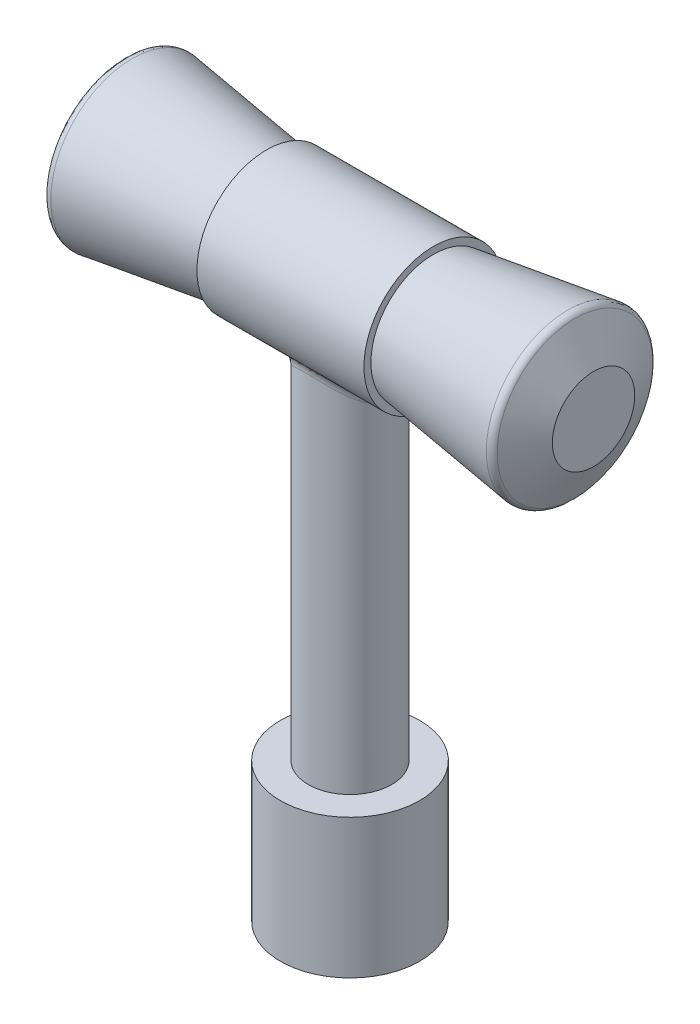
from build123d import *

# Parameters (mm, degrees)
SKETCH3_R                            = 5
BOSS_EXTRUDE1_DEPTH                  = 6
SKETCH4_R                            = 4.5
BOSS_EXTRUDE2_DEPTH                  = 10
BOSS_EXTRUDE2_DRAFT                  = -8
MIRROR1_COPY_1_SKETCH_R              = 4.5
MIRROR1_COPY_1_DEPTH                 = 10
MIRROR1_COPY_1_DRAFT                 = -8
SKETCH5_R                            = 3
BOSS_EXTRUDE3_DEPTH                  = 25
BOSS_EXTRUDE3_DIRECTION_2_REACH      = 22.244
BOSS_EXTRUDE3_DIRECTION_2_END_RADIUS = 5
SKETCH6_R                            = 5
BOSS_EXTRUDE4_DEPTH                  = 10
F_5_0MM_DOWEL_HOLE1_D                = 5
F_5_0MM_DOWEL_HOLE1_DEPTH            = 10
F_5_0MM_DOWEL_HOLE1_TIP              = 1.502151548
SKETCH9_R                            = 5.905408347
BOSS_EXTRUDE5_DEPTH                  = 1.5
BOSS_EXTRUDE5_TAPER                  = 63
FILLET1_R                            = 1
FILLET2_R                            = 0.5


with BuildPart() as part:
    # Sketch3 → Boss-Extrude1 (new, symmetric)
    with BuildSketch(Plane(origin=(0, 0, 0), x_dir=(0, 0, -1), z_dir=(1, 0, 0))):
        with Locations((0, 40)):
            Circle(SKETCH3_R)
    extrude(amount=BOSS_EXTRUDE1_DEPTH, both=True)


with BuildPart() as boss_extrude2_tool:
    # Sketch4 → Boss-Extrude2 (with draft: the straight prism first)
    with BuildSketch(Plane(origin=(6, 0, 0), x_dir=(0, 0, -1), z_dir=(1, 0, 0))):
        with Locations((0, 40)):
            Circle(SKETCH4_R)
    extrude(amount=BOSS_EXTRUDE2_DEPTH)
    # Boss-Extrude2: the draft: its side faces are tilted about the plane it starts from
    boss_extrude2_sides = [boss_extrude2_tool.faces().sort_by_distance(p)[0] for p in [
        (11, 40, 4.5),
    ]]
    draft(boss_extrude2_sides, Plane(origin=(6, 0, 0), x_dir=(0, 0, -1), z_dir=(1, 0, 0)), BOSS_EXTRUDE2_DRAFT)


with BuildPart() as part_1:
    add(part.part)

    # Boss-Extrude2: add boss_extrude2_tool
    add(boss_extrude2_tool.part)


with BuildPart() as mirror1_copy_1_tool:
    # Mirror1 copy 1 sketch → Mirror1 copy 1 (with draft: the straight prism first)
    with BuildSketch(Plane(origin=(-6, 0, 0), x_dir=(0, 0, -1), z_dir=(-1, 0, 0))):
        with Locations((0, -40)):
            Circle(MIRROR1_COPY_1_SKETCH_R)
    extrude(amount=MIRROR1_COPY_1_DEPTH)
    # Mirror1 copy 1: the draft: its side faces are tilted about the plane it starts from
    mirror1_copy_1_sides = [mirror1_copy_1_tool.faces().sort_by_distance(p)[0] for p in [
        (-11, 40, 4.5),
    ]]
    draft(mirror1_copy_1_sides, Plane(origin=(-6, 0, 0), x_dir=(0, 0, -1), z_dir=(-1, 0, 0)), MIRROR1_COPY_1_DRAFT)


with BuildPart() as part_2:
    add(part_1.part)

    # Mirror1 copy 1: add mirror1_copy_1_tool
    add(mirror1_copy_1_tool.part)

    # Sketch5 → Boss-Extrude3 (add)
    with BuildSketch(Plane(origin=(0, 35, 0), x_dir=(-1, 0, 0), z_dir=(0, -1, 0))):
        with Locations(Location((0, 0, 0), (0, 0, 270))):
            Circle(SKETCH5_R)
    extrude(amount=BOSS_EXTRUDE3_DEPTH)

    # Boss-Extrude3 direction 2: up to this cylinder (the profile starts outside it)
    boss_extrude3_direction_2_end = Plane(origin=(0, 40, 0), z_dir=(-1, 0, 0)) * Cylinder(BOSS_EXTRUDE3_DIRECTION_2_END_RADIUS, 55.488, mode=Mode.PRIVATE)
    # Sketch5 → Boss-Extrude3 direction 2 (add, up to the surface)
    with BuildSketch(Plane(origin=(0, 35, 0), x_dir=(-1, 0, 0), z_dir=(0, -1, 0)), mode=Mode.PRIVATE) as boss_extrude3_direction_2_sk1:
        with Locations(Location((0, 0, 0), (0, 0, 270))):
            Circle(SKETCH5_R)
    boss_extrude3_direction_2_tool1 = extrude(boss_extrude3_direction_2_sk1.sketch, amount=-BOSS_EXTRUDE3_DIRECTION_2_REACH, mode=Mode.PRIVATE) - boss_extrude3_direction_2_end
    add(boss_extrude3_direction_2_tool1.solids().sort_by_distance((0, 35, 0))[0])
    add(boss_extrude3_direction_2_tool1.solids().sort_by_distance((0, 35, 0))[1])

    # Sketch6 → Boss-Extrude4 (add)
    with BuildSketch(Plane.XZ.offset(-10)):
        with Locations(Location((0, 0, 0), (0, 0, 270))):
            Circle(SKETCH6_R)
    extrude(amount=BOSS_EXTRUDE4_DEPTH)

    # Ø5.0mm Dowel Hole1
    with Locations(Plane(origin=(0, 0, 0), x_dir=(-1, 0, 0), z_dir=(0, -1, 0))):
        with Locations((0, 0)):
            Hole(F_5_0MM_DOWEL_HOLE1_D / 2, depth=F_5_0MM_DOWEL_HOLE1_DEPTH)
            with Locations((0, 0, -(F_5_0MM_DOWEL_HOLE1_DEPTH + F_5_0MM_DOWEL_HOLE1_TIP / 2))):  # 118° drill point
                Cone(0, F_5_0MM_DOWEL_HOLE1_D / 2, F_5_0MM_DOWEL_HOLE1_TIP, mode=Mode.SUBTRACT)

    # Sketch9 → Boss-Extrude5 (add)
    with BuildSketch(Plane(origin=(16, 0, 0), x_dir=(0, 0, -1), z_dir=(1, 0, 0))):
        with Locations((0, 40)):
            Circle(SKETCH9_R)
    boss_extrude5 = extrude(amount=BOSS_EXTRUDE5_DEPTH, taper=BOSS_EXTRUDE5_TAPER)

    # Mirror2: Boss-Extrude5 across plane
    add(boss_extrude5.mirror(Plane(origin=(0, 0, 0), x_dir=(0, 0, 1), z_dir=(1, 0, 0))))

    # Fillet1
    fillet1_edges = [part_2.edges().sort_by_distance(p)[0] for p in [
        (3.000000007, 34.999999994, -1e-09),
    ]]
    fillet(fillet1_edges, radius=FILLET1_R)

    # Fillet2
    fillet2_edges = [part_2.edges().sort_by_distance(p)[0] for p in [
        (-16, 40, 5.905408347),
        (16, 40, 5.905408347),
    ]]
    fillet(fillet2_edges, radius=FILLET2_R)


solid = part_2.part
